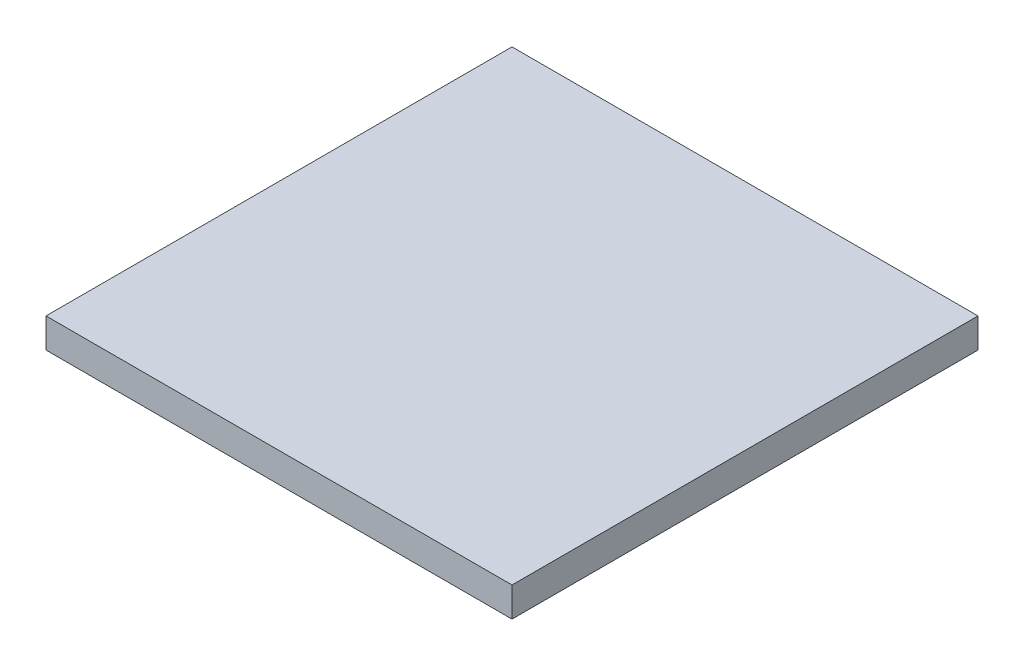
from build123d import *

# Parameters (mm, degrees)
SKETCH1_W           = 300
SKETCH1_H           = 300
BOSS_EXTRUDE1_DEPTH = 19.05


with BuildPart() as part:
    # Sketch1 → Boss-Extrude1 (new body)
    with BuildSketch(Plane(origin=(0, 0, 0), x_dir=(1, 0, 0), z_dir=(0, 1, 0))):
        with Locations((150, 150)):
            Rectangle(SKETCH1_W, SKETCH1_H)
    extrude(amount=BOSS_EXTRUDE1_DEPTH)


solid = part.part
